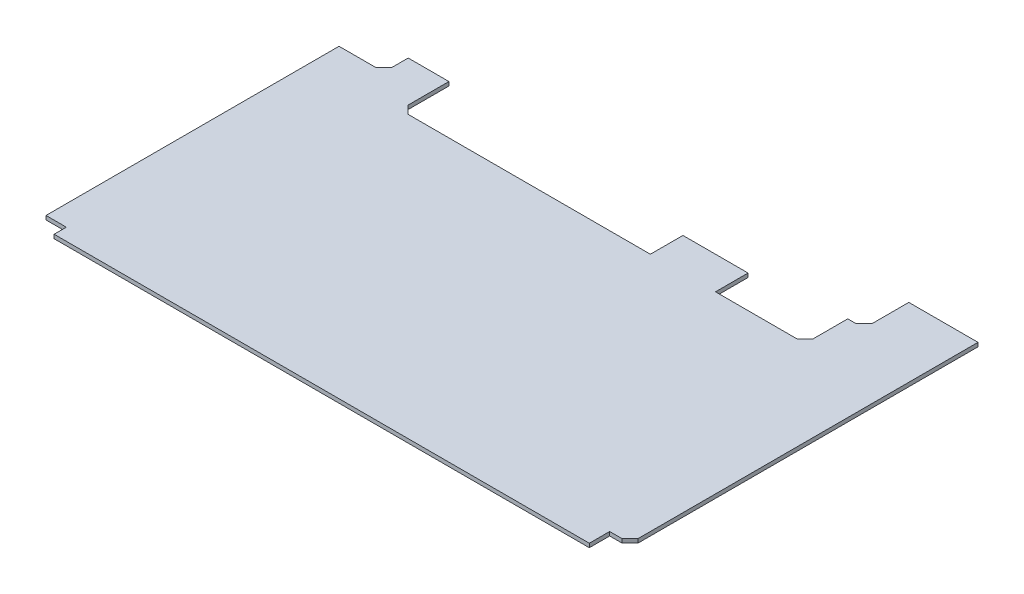
from build123d import *

# Parameters (mm, degrees)
SKETCH1_W           = 224.63125
SKETCH1_H           = 143.66875
BOSS_EXTRUDE1_DEPTH = 1.524
CUT_EXTRUDE1_REACH  = 135.332
SKETCH2_W           = 157.95625
SKETCH2_H           = 34.13125
CHAMFER1_SIZE       = 3.175
SKETCH3_W           = 25.4
SKETCH3_H           = 12.7
BOSS_EXTRUDE2_DEPTH = 1.524
CUT_EXTRUDE2_REACH  = 135.332
CUT_EXTRUDE3_REACH  = 135.332
SKETCH5_W           = 6.35
SKETCH5_H           = 17.4625
CHAMFER2_SIZE       = 3.175
CUT_EXTRUDE4_REACH  = 135.332
SKETCH6_W           = 7.9375
SKETCH6_H           = 4.7625
SKETCH6_H_2         = 7.9375
CHAMFER3_SIZE       = 3.175


with BuildPart() as part:
    # Sketch1 → Boss-Extrude1 (new body)
    with BuildSketch(Plane(origin=(0, 0, 0), x_dir=(1, 0, 0), z_dir=(0, 1, 0))):
        Rectangle(SKETCH1_W, SKETCH1_H)
    extrude(amount=BOSS_EXTRUDE1_DEPTH)

    # Sketch2 → Cut-Extrude1 (cut, up to next)
    with BuildSketch(Plane(origin=(0, 1.524, 0), x_dir=(1, 0, 0), z_dir=(0, 1, 0)), mode=Mode.PRIVATE) as cut_extrude1_sk1:
        with Locations((0, 54.76875)):
            Rectangle(SKETCH2_W, SKETCH2_H)
    cut_extrude1_tool1 = extrude(cut_extrude1_sk1.sketch, amount=-CUT_EXTRUDE1_REACH, mode=Mode.PRIVATE) & part.part
    add(cut_extrude1_tool1.solids().sort_by_distance((0, 1.524, -54.76875))[0], mode=Mode.SUBTRACT)

    # Chamfer1
    chamfer1_edges = [part.edges().sort_by_distance(p)[0] for p in [
        (-78.978125, 0.762, -37.703125),
        (78.978125, 0.762, -37.703125),
    ]]
    chamfer(chamfer1_edges, length=CHAMFER1_SIZE)

    # Sketch3 → Boss-Extrude2 (add)
    with BuildSketch(Plane(origin=(0, 1.524, 0), x_dir=(1, 0, 0), z_dir=(0, 1, 0))):
        with Locations((31.353125, 44.053125)):
            Rectangle(SKETCH3_W, SKETCH3_H)
    extrude(amount=-BOSS_EXTRUDE2_DEPTH)

    # Sketch4 → Cut-Extrude2 (cut, up to next)
    with BuildSketch(Plane(origin=(0, 1.524, 0), x_dir=(1, 0, 0), z_dir=(0, 1, 0)), mode=Mode.PRIVATE) as cut_extrude2_sk1:
        Polygon((-78.978125, 56.753125), (-94.853125, 56.753125), (-94.853125, 47.228125), (-112.315625, 47.228125), (-112.315625, 71.834375), (-78.978125, 71.834375), align=None)
    cut_extrude2_tool1 = extrude(cut_extrude2_sk1.sketch, amount=-CUT_EXTRUDE2_REACH, mode=Mode.PRIVATE) & part.part
    add(cut_extrude2_tool1.solids().sort_by_distance((-97.620039, 1.524, -61.235346))[0], mode=Mode.SUBTRACT)

    # Sketch5 → Cut-Extrude3 (cut, up to next)
    with BuildSketch(Plane(origin=(0, 1.524, 0), x_dir=(1, 0, 0), z_dir=(0, 1, 0)), mode=Mode.PRIVATE) as cut_extrude3_sk1:
        with Locations((82.153125, 63.103125)):
            Rectangle(SKETCH5_W, SKETCH5_H)
    cut_extrude3_tool1 = extrude(cut_extrude3_sk1.sketch, amount=-CUT_EXTRUDE3_REACH, mode=Mode.PRIVATE) & part.part
    add(cut_extrude3_tool1.solids().sort_by_distance((82.153125, 1.524, -63.103125))[0], mode=Mode.SUBTRACT)

    # Chamfer2
    chamfer2_edges = [part.edges().sort_by_distance(p)[0] for p in [
        (-94.853125, 0.762, -47.228125),
        (85.328125, 0.762, -54.371875),
    ]]
    chamfer(chamfer2_edges, length=CHAMFER2_SIZE)

    # Sketch6 → Cut-Extrude4 (cut, up to next)
    with BuildSketch(Plane(origin=(0, 1.524, 0), x_dir=(1, 0, 0), z_dir=(0, 1, 0)), mode=Mode.PRIVATE) as cut_extrude4_sk1:
        with Locations((-108.346875, -69.453125)):
            Rectangle(SKETCH6_W, SKETCH6_H)
    cut_extrude4_tool1 = extrude(cut_extrude4_sk1.sketch, amount=-CUT_EXTRUDE4_REACH, mode=Mode.PRIVATE) & part.part
    # Sketch6 → Cut-Extrude4 (cut, up to next)
    with BuildSketch(Plane(origin=(0, 1.524, 0), x_dir=(1, 0, 0), z_dir=(0, 1, 0)), mode=Mode.PRIVATE) as cut_extrude4_sk2:
        with Locations((108.346875, -67.865625)):
            Rectangle(SKETCH6_W, SKETCH6_H_2)
    cut_extrude4_tool2 = extrude(cut_extrude4_sk2.sketch, amount=-CUT_EXTRUDE4_REACH, mode=Mode.PRIVATE) & part.part
    add(cut_extrude4_tool1.solids().sort_by_distance((-108.346875, 1.524, 69.453125))[0], mode=Mode.SUBTRACT)
    add(cut_extrude4_tool2.solids().sort_by_distance((108.346875, 1.524, 67.865625))[0], mode=Mode.SUBTRACT)

    # Chamfer3
    chamfer3_edges = [part.edges().sort_by_distance(p)[0] for p in [
        (112.315625, 0.762, 63.896875),
    ]]
    chamfer(chamfer3_edges, length=CHAMFER3_SIZE)


solid = part.part
